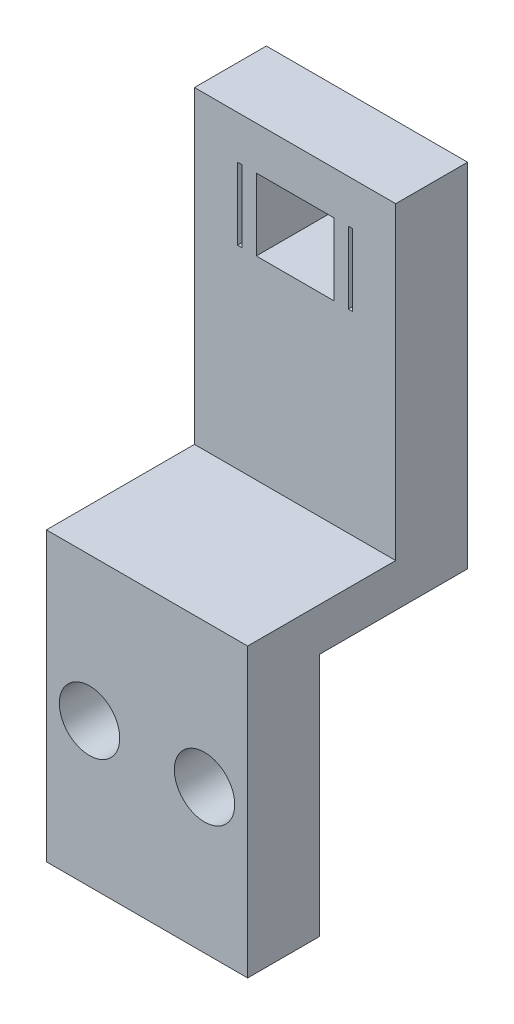
from build123d import *

# Parameters (mm, degrees)
SKETCH1_W           = 14
SKETCH1_H           = 41.5
SKETCH1_R           = 2.1
SKETCH1_W_2         = 1
SKETCH1_H_2         = 5
BOSS_EXTRUDE3_DEPTH = 15.3
SKETCH2_W           = 10.3
SKETCH2_H           = 17
SKETCH2_H_2         = 21.5
CUT_EXTRUDE1_DEPTH  = 21


with BuildPart() as part:
    # Sketch1 → Boss-Extrude3 (new body)
    # profile 1 of 3: a face of its own
    with BuildSketch(Plane.XY):
        with Locations((7, 20.75)):
            Rectangle(SKETCH1_W, SKETCH1_H)
        with Locations((3, 10)):
            Circle(SKETCH1_R, mode=Mode.SUBTRACT)
        with Locations((11, 10)):
            Circle(SKETCH1_R, mode=Mode.SUBTRACT)
        Polygon((3.3, 38.5), (4.3, 38.5), (9.7, 38.5), (10.7, 38.5), (11, 38.5), (11, 33.5), (10.7, 33.5), (9.7, 33.5), (4.3, 33.5), (3.3, 33.5), (3, 33.5), (3, 38.5), align=None, mode=Mode.SUBTRACT)
    # profile 2 of 3: a face of its own
    with BuildSketch(Plane.XY):
        with Locations((3.8, 36)):
            Rectangle(SKETCH1_W_2, SKETCH1_H_2)
    # profile 3 of 3: a face of its own
    with BuildSketch(Plane.XY):
        with Locations((10.2, 36)):
            Rectangle(SKETCH1_W_2, SKETCH1_H_2)
    extrude(amount=BOSS_EXTRUDE3_DEPTH)

    # Sketch2 → Cut-Extrude1 (cut)
    with BuildSketch(Plane.ZY):
        with Locations((5.15, 8.5)):
            Rectangle(SKETCH2_W, SKETCH2_H)
        with Locations((10.15, 30.75)):
            Rectangle(SKETCH2_W, SKETCH2_H_2)
    extrude(amount=-CUT_EXTRUDE1_DEPTH, mode=Mode.SUBTRACT)


solid = part.part
